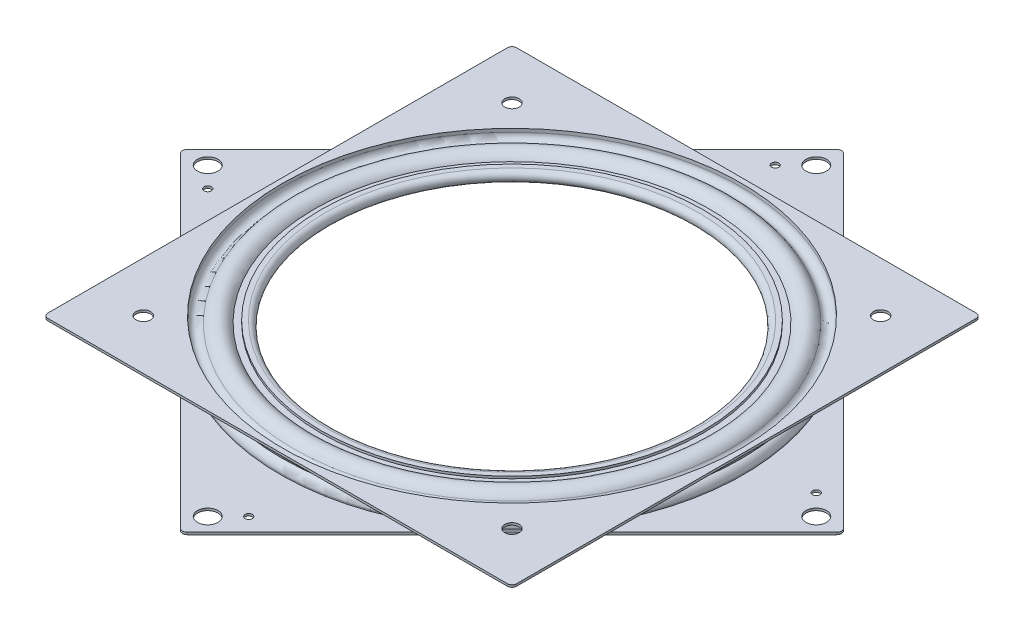
from build123d import *

# Parameters (mm, degrees)
SKETCH4_W               = 153.924
SKETCH4_H               = 153.924
SKETCH4_R               = 75.348209056
BOSS_EXTRUDE1_DEPTH     = 0.7366
BOSS_EXTRUDE2_START     = -0.7366
SKETCH5_R               = 75.348209056
BOSS_EXTRUDE2_DEPTH     = 0.7366
CUT_EXTRUDE1_DEPTH      = 154.974341193
CUT_EXTRUDE1_DEPTH_BACK = 154.974341193
SKETCH6_R               = 2.38125
CUT_EXTRUDE2_DEPTH      = 154.974341193
CUT_EXTRUDE2_DEPTH_BACK = 154.974341193
SKETCH7_R               = 3.3734375
SKETCH7_R_2             = 1.1922125
FILLET1_R               = 1.53924
FILLET2_R               = 1.53924


with BuildPart() as part:
    # Sketch3 → Revolve-Thin1 (revolve)
    with BuildSketch(Plane.XY, mode=Mode.PRIVATE) as revolve_thin1_sk:
        with BuildLine():
            Line((76.962, -3.937), (75.348209056, -3.937))
            Line((75.348209056, -3.937), (75.348209056, -2.83464))
            ThreePointArc((75.348209056, -2.83464), (73.867348091, -0.927495427), (71.652806037, -1.88976))
            ThreePointArc((71.652806037, -1.88976), (67.651879497, -3.898798296), (64.358457004, -0.86614))
            Line((64.358457004, -0.86614), (61.20765, -0.86614))
            ThreePointArc((61.20765, -0.86614), (59.436, 0.90551), (61.20765, 2.67716))
            Line((61.20765, 2.67716), (62.783053502, 2.67716))
            Line((62.783053502, 2.67716), (62.783053502, 1.94056))
            Line((62.783053502, 1.94056), (61.20765, 1.94056))
            ThreePointArc((61.20765, 1.94056), (60.1726, 0.90551), (61.20765, -0.12954))
            Line((61.20765, -0.12954), (65.001222718, -0.12954))
            ThreePointArc((65.001222718, -0.12954), (67.469119821, -3.116060828), (71.006610069, -1.536192))
            ThreePointArc((71.006610069, -1.536192), (74.049819472, -0.213854232), (76.084809056, -2.83464))
            Line((76.084809056, -2.83464), (76.084809056, -3.2004))
            Line((76.084809056, -3.2004), (76.962, -3.2004))
            Line((76.962, -3.2004), (76.962, -3.937))
        make_face()
    revolve(revolve_thin1_sk.sketch.rotate(Axis((0, 3.937, 0), (0, -1, 0)), 180), axis=Axis((0, 3.937, 0), (0, -1, 0)))

    # Sketch5 → Boss-Extrude2 (add)
    with BuildSketch(Plane.XZ.offset(3.937).offset(BOSS_EXTRUDE2_START)):
        Polygon((-108.840704187, 0), (0, 108.840704187), (108.840704187, 0), (0, -108.840704187), align=None)
        with Locations(Location((0, 0, 0), (0, 0, 180))):
            Circle(SKETCH5_R, mode=Mode.SUBTRACT)
    extrude(amount=BOSS_EXTRUDE2_DEPTH)

    # Sketch7 → Cut-Extrude2 (cut, two sides: drawn at the far end of the back side and taken through both)
    with BuildSketch(Plane(origin=(0, 0, 0), x_dir=(1, 0, 0), z_dir=(0, 1, 0)).offset(-CUT_EXTRUDE2_DEPTH_BACK)):
        with Locations(Location((99.905349347, 0, 0), (0, 0, 270))):
            Circle(SKETCH7_R)
        with Locations(Location((0, 99.905349347, 0), (0, 0, 270))):
            Circle(SKETCH7_R)
        with Locations(Location((-99.905349347, 0, 0), (0, 0, 270))):
            Circle(SKETCH7_R)
        with Locations(Location((0, -99.905349347, 0), (0, 0, 270))):
            Circle(SKETCH7_R)
        with Locations(Location((6.735192091, -93.170157256, 0), (0, 0, 270))):
            Circle(SKETCH7_R_2)
        with Locations(Location((-93.170157256, -6.735192091, 0), (0, 0, 270))):
            Circle(SKETCH7_R_2)
        with Locations(Location((-6.735192091, 93.170157256, 0), (0, 0, 270))):
            Circle(SKETCH7_R_2)
        with Locations(Location((93.170157256, 6.735192091, 0), (0, 0, 270))):
            Circle(SKETCH7_R_2)
    extrude(amount=CUT_EXTRUDE2_DEPTH + CUT_EXTRUDE2_DEPTH_BACK, mode=Mode.SUBTRACT)

    # Fillet2
    fillet2_edges = [part.edges().sort_by_distance(p)[0] for p in [
        (0, -3.5687, -108.840704187),
        (-108.840704187, -3.5687, 0),
        (0, -3.5687, 108.840704187),
        (108.840704187, -3.5687, 0),
    ]]
    fillet(fillet2_edges, radius=FILLET2_R)


with BuildPart() as body_2:
    # Sketch3<3> → Revolve-Thin2 (revolve)
    with BuildSketch(Plane.XY, mode=Mode.PRIVATE) as revolve_thin2_sk:
        with BuildLine():
            Line((76.962, 3.937), (75.348209056, 3.937))
            Line((75.348209056, 3.937), (75.348209056, 2.83464))
            ThreePointArc((75.348209056, 2.83464), (73.867348091, 0.927495427), (71.652806037, 1.88976))
            ThreePointArc((71.652806037, 1.88976), (68.228071759, 3.936892662), (64.773478742, 1.94056))
            Line((64.773478742, 1.94056), (61.20765, 1.94056))
            Line((61.20765, 1.94056), (61.20765, 1.20396))
            Line((61.20765, 1.20396), (65.233693864, 1.20396))
            ThreePointArc((65.233693864, 1.20396), (68.015120861, 3.195113241), (71.006610069, 1.536192))
            ThreePointArc((71.006610069, 1.536192), (74.049819472, 0.213854232), (76.084809056, 2.83464))
            Line((76.084809056, 2.83464), (76.084809056, 3.2004))
            Line((76.084809056, 3.2004), (76.962, 3.2004))
            Line((76.962, 3.2004), (76.962, 3.937))
        make_face()
    revolve(revolve_thin2_sk.sketch.rotate(Axis((0, 3.937, 0), (0, -1, 0)), 180), axis=Axis((0, 3.937, 0), (0, -1, 0)))

    # Sketch4 → Boss-Extrude1 (add)
    with BuildSketch(Plane(origin=(0, 3.937, 0), x_dir=(1, 0, 0), z_dir=(0, 1, 0))):
        Rectangle(SKETCH4_W, SKETCH4_H)
        with Locations(Location((0, 0, 0), (0, 0, 180))):
            Circle(SKETCH4_R, mode=Mode.SUBTRACT)
    extrude(amount=-BOSS_EXTRUDE1_DEPTH)

    # Sketch6 → Cut-Extrude1 (cut, two sides: drawn at the far end of the back side and taken through both)
    with BuildSketch(Plane(origin=(0, 0, 0), x_dir=(1, 0, 0), z_dir=(0, 1, 0)).offset(-CUT_EXTRUDE1_DEPTH_BACK)):
        with Locations(Location((-60.5282, 60.5282, 0), (0, 0, 270))):
            Circle(SKETCH6_R)
        with Locations(Location((-60.5282, -60.5282, 0), (0, 0, 270))):
            Circle(SKETCH6_R)
        with Locations(Location((60.5282, -60.5282, 0), (0, 0, 270))):
            Circle(SKETCH6_R)
        with Locations(Location((60.5282, 60.5282, 0), (0, 0, 270))):
            Circle(SKETCH6_R)
    extrude(amount=CUT_EXTRUDE1_DEPTH + CUT_EXTRUDE1_DEPTH_BACK, mode=Mode.SUBTRACT)

    # Fillet1
    fillet1_edges = [body_2.edges().sort_by_distance(p)[0] for p in [
        (-76.962, 3.5687, 76.962),
        (-76.962, 3.5687, -76.962),
        (76.962, 3.5687, -76.962),
        (76.962, 3.5687, 76.962),
    ]]
    fillet(fillet1_edges, radius=FILLET1_R)


with BuildPart() as body_3:
    # Sketch8 → Revolve1 (revolve)
    with BuildSketch(Plane.XY):
        with BuildLine():
            Line((68.199, -3.683), (68.199, 3.683))
            ThreePointArc((68.199, 3.683), (71.882, 0), (68.199, -3.683))
        make_face()
    revolve(axis=Axis((68.199, -3.683, 0), (0, 1, 0)))


solid = Compound([part.part, body_2.part, body_3.part])
